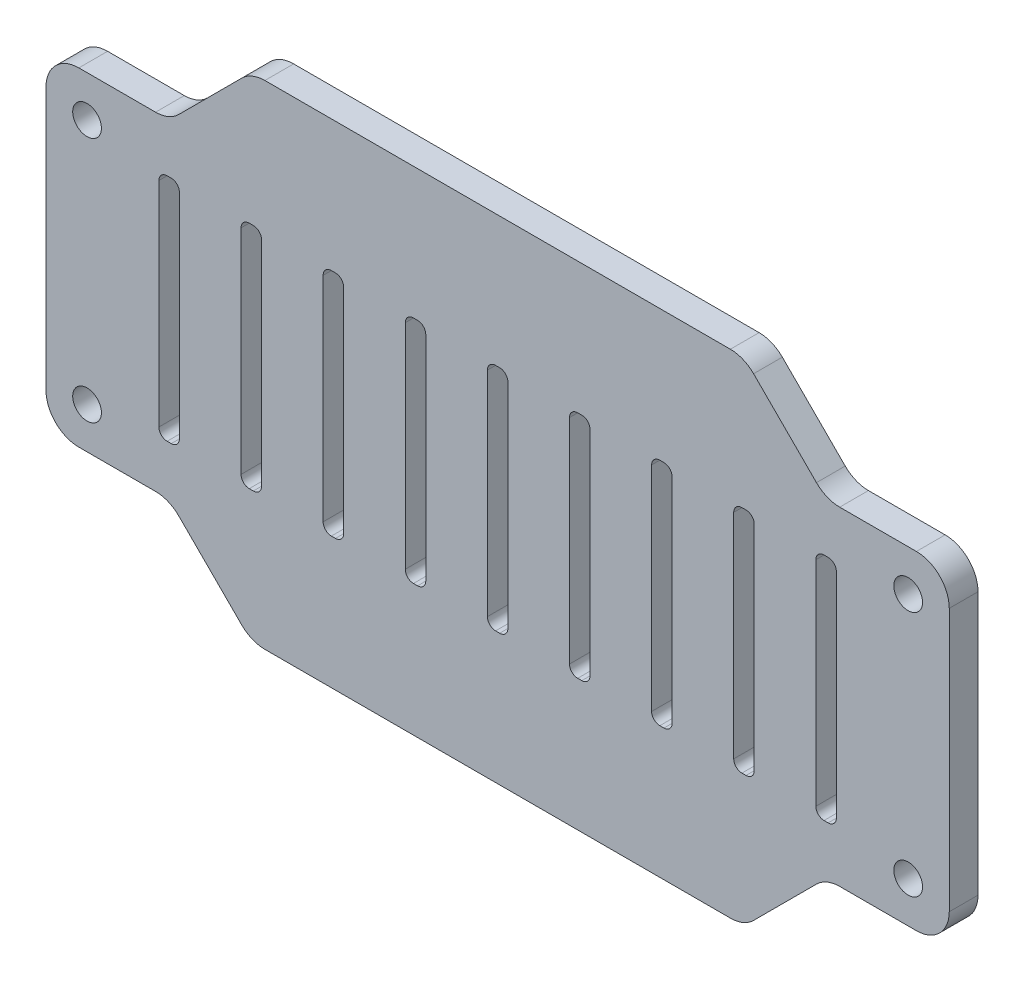
from build123d import *

# Parameters (mm, degrees)
BOSS_EXTRUDE1_DEPTH = 3.5
FILLET1_R           = 4
SKETCH2_R           = 1.75
CUT_EXTRUDE1_DEPTH  = 63.747509911
CUT_EXTRUDE2_DEPTH  = 63.747509911
LPATTERN1_COUNT     = 5
LPATTERN1_PITCH     = 10
LPATTERN1_COL_COUNT = 5
LPATTERN1_COL_PITCH = 10


with BuildPart() as part:
    # Sketch1 → Boss-Extrude1 (new body)
    with BuildSketch(Plane.XY):
        Polygon((-55, 20), (-40, 20), (-30, 30), (30, 30), (40, 20), (55, 20), (55, -20), (40, -20), (30, -30), (-30, -30), (-40, -20), (-55, -20), align=None)
    extrude(amount=BOSS_EXTRUDE1_DEPTH)

    # Fillet1
    fillet1_edges = [part.edges().sort_by_distance(p)[0] for p in [
        (-55, -20, 1.75),
        (-55, 20, 1.75),
        (-40, 20, 1.75),
        (-30, 30, 1.75),
        (30, 30, 1.75),
        (40, 20, 1.75),
        (55, 20, 1.75),
        (55, -20, 1.75),
        (40, -20, 1.75),
        (30, -30, 1.75),
        (-30, -30, 1.75),
        (-40, -20, 1.75),
    ]]
    fillet(fillet1_edges, radius=FILLET1_R)

    # Sketch2 → Cut-Extrude1 (cut, through all)
    with BuildSketch(Plane.XY.offset(3.5)):
        with Locations((-50, 15)):
            Circle(SKETCH2_R)
        with Locations((-50, -15)):
            Circle(SKETCH2_R)
        with Locations((50, -15)):
            Circle(SKETCH2_R)
        with Locations((50, 15)):
            Circle(SKETCH2_R)
    extrude(amount=-CUT_EXTRUDE1_DEPTH, mode=Mode.SUBTRACT)

    # Sketch3 → Cut-Extrude2 (cut, through all)
    with BuildSketch(Plane.XY.offset(3.5)):
        with BuildLine():
            Line((-0.25, 14), (0.25, 14))
            ThreePointArc((0.25, 14), (0.957106781, 13.707106781), (1.25, 13))
            Line((1.25, 13), (1.25, -13))
            ThreePointArc((1.25, -13), (0.957106781, -13.707106781), (0.25, -14))
            Line((0.25, -14), (-0.25, -14))
            ThreePointArc((-0.25, -14), (-0.957106781, -13.707106781), (-1.25, -13))
            Line((-1.25, -13), (-1.25, 13))
            ThreePointArc((-1.25, 13), (-0.957106781, 13.707106781), (-0.25, 14))
        make_face()
    cut_extrude2 = extrude(amount=-CUT_EXTRUDE2_DEPTH, mode=Mode.SUBTRACT)

    # LPattern1: Cut-Extrude2 ×5
    with Locations(*[(-i * LPATTERN1_PITCH, 0, 0) for i in range(1, LPATTERN1_COUNT)]):
        add(cut_extrude2, mode=Mode.SUBTRACT)

    # LPattern1 col: Cut-Extrude2 ×5
    with Locations(*[(i * LPATTERN1_COL_PITCH, 0, 0) for i in range(1, LPATTERN1_COL_COUNT)]):
        add(cut_extrude2, mode=Mode.SUBTRACT)


solid = part.part
